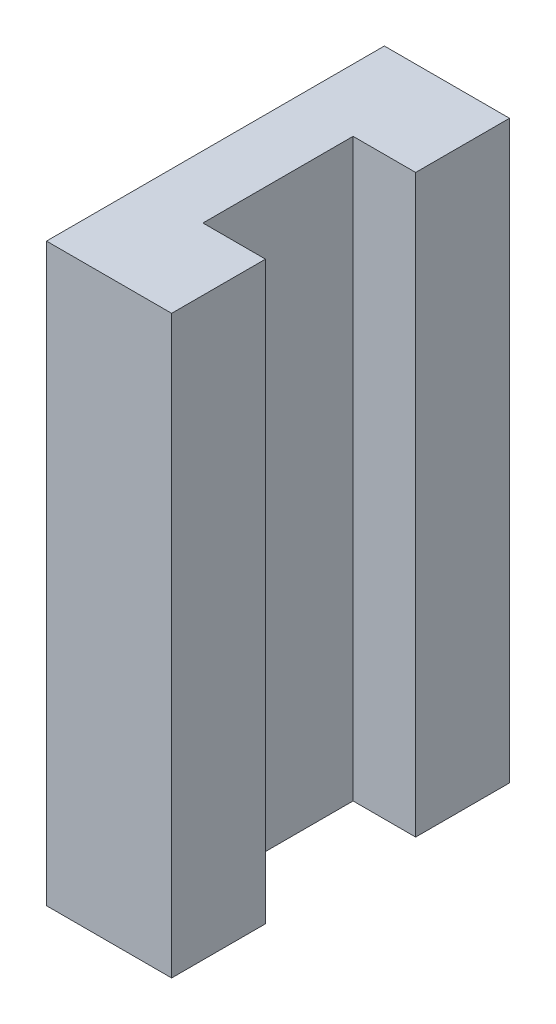
from build123d import *

# Parameters (mm, degrees)
BOSS_EXTRUDE1_DEPTH   = 46
M3_TAPPED_HOLE1_D     = 2.5
M3_TAPPED_HOLE1_DEPTH = 7.5
M3_TAPPED_HOLE1_TIP   = 0.751075774


with BuildPart() as part:
    # Sketch1 → Boss-Extrude1 (new body)
    with BuildSketch(Plane(origin=(0, 0, 0), x_dir=(1, 0, 0), z_dir=(0, 1, 0))):
        Polygon((5, 6), (5, 13.5), (-5, 13.5), (-5, -13.5), (5, -13.5), (5, -6), (0, -6), (0, 6), align=None)
    extrude(amount=BOSS_EXTRUDE1_DEPTH)

    # M3 Tapped Hole1
    with Locations(Plane.ZY.offset(5)):
        with Locations((10, 33), (-10, 33), (-10, 13), (10, 13)):
            Hole(M3_TAPPED_HOLE1_D / 2, depth=M3_TAPPED_HOLE1_DEPTH)
            with Locations((0, 0, -(M3_TAPPED_HOLE1_DEPTH + M3_TAPPED_HOLE1_TIP / 2))):  # 118° drill point
                Cone(0, M3_TAPPED_HOLE1_D / 2, M3_TAPPED_HOLE1_TIP, mode=Mode.SUBTRACT)


solid = part.part
